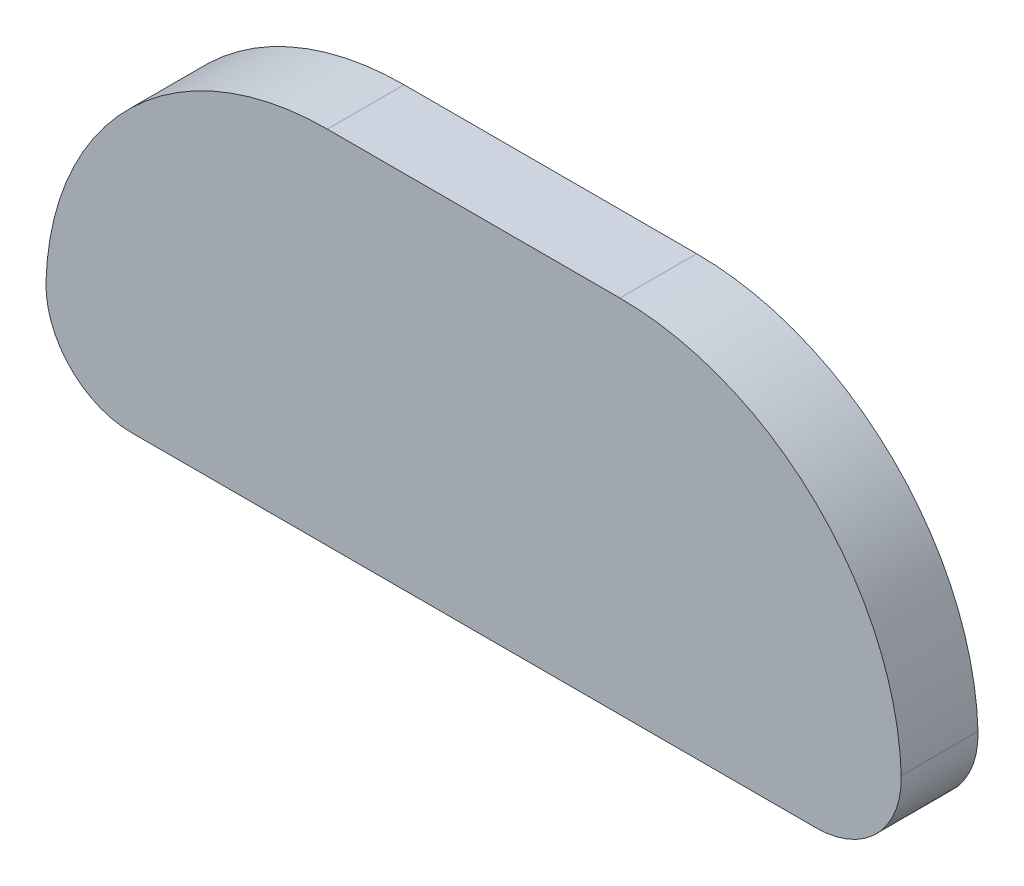
from build123d import *

# Parameters (mm, degrees)
ESBO_O1_W                = 100.3
ESBO_O1_H                = 42.3
ESBO_O1_R                = 5.15
RESSALTO_EXTRUS_O1_DEPTH = 7
RESSALTO_EXTRUS_O2_START = 7
ESBO_O1_6_W              = 100.3
ESBO_O1_6_H              = 42.3
ESBO_O1_6_R              = 5.15
RESSALTO_EXTRUS_O2_DEPTH = 2
FILETE1_R                = 33
FILETE2_R                = 10


with BuildPart() as part:
    # Esboço1 → Ressalto-extrusão1 (new body)
    with BuildSketch(Plane.XY):
        with Locations((0.087398189, -10.441132561)):
            Rectangle(ESBO_O1_W, ESBO_O1_H)
        with Locations((-16.508590221, 3.558867439)):
            Circle(ESBO_O1_R, mode=Mode.SUBTRACT)
        with Locations((16.491409779, 3.558867439)):
            Circle(ESBO_O1_R, mode=Mode.SUBTRACT)
        with Locations((-39.912601811, -21.441132561)):
            Circle(ESBO_O1_R, mode=Mode.SUBTRACT)
        with Locations((40.087398189, -21.441132561)):
            Circle(ESBO_O1_R, mode=Mode.SUBTRACT)
    extrude(amount=RESSALTO_EXTRUS_O1_DEPTH)

    # Esboço1<6> → Ressalto-extrusão2 (add)
    # profile 1 of 5: a face of its own
    with BuildSketch(Plane.XY.offset(RESSALTO_EXTRUS_O2_START)):
        with Locations((0.087398189, -10.441132561)):
            Rectangle(ESBO_O1_6_W, ESBO_O1_6_H)
        with Locations((16.491409779, 3.558867439)):
            Circle(ESBO_O1_6_R, mode=Mode.SUBTRACT)
        with Locations((-16.508590221, 3.558867439)):
            Circle(ESBO_O1_6_R, mode=Mode.SUBTRACT)
        with Locations((-39.912601811, -21.441132561)):
            Circle(ESBO_O1_6_R, mode=Mode.SUBTRACT)
        with Locations((40.087398189, -21.441132561)):
            Circle(ESBO_O1_6_R, mode=Mode.SUBTRACT)
    # profile 2 of 5: a face of its own
    with BuildSketch(Plane.XY.offset(RESSALTO_EXTRUS_O2_START)):
        with Locations((40.087398189, -21.441132561)):
            Circle(ESBO_O1_6_R)
    # profile 3 of 5: a face of its own
    with BuildSketch(Plane.XY.offset(RESSALTO_EXTRUS_O2_START)):
        with Locations((-39.912601811, -21.441132561)):
            Circle(ESBO_O1_6_R)
    # profile 4 of 5: a face of its own
    with BuildSketch(Plane.XY.offset(RESSALTO_EXTRUS_O2_START)):
        with Locations((16.491409779, 3.558867439)):
            Circle(ESBO_O1_6_R)
    # profile 5 of 5: a face of its own
    with BuildSketch(Plane.XY.offset(RESSALTO_EXTRUS_O2_START)):
        with Locations((-16.508590221, 3.558867439)):
            Circle(ESBO_O1_6_R)
    extrude(amount=RESSALTO_EXTRUS_O2_DEPTH)

    # Filete1
    filete1_edges = [part.edges().sort_by_distance(p)[0] for p in [
        (50.237398189, 10.708867439, 4.5),
        (-50.062601811, 10.708867439, 4.5),
    ]]
    fillet(filete1_edges, radius=FILETE1_R)

    # Filete2
    filete2_edges = [part.edges().sort_by_distance(p)[0] for p in [
        (50.237398189, -31.591132561, 4.5),
        (-50.062601811, -31.591132561, 4.5),
    ]]
    fillet(filete2_edges, radius=FILETE2_R)


solid = part.part
